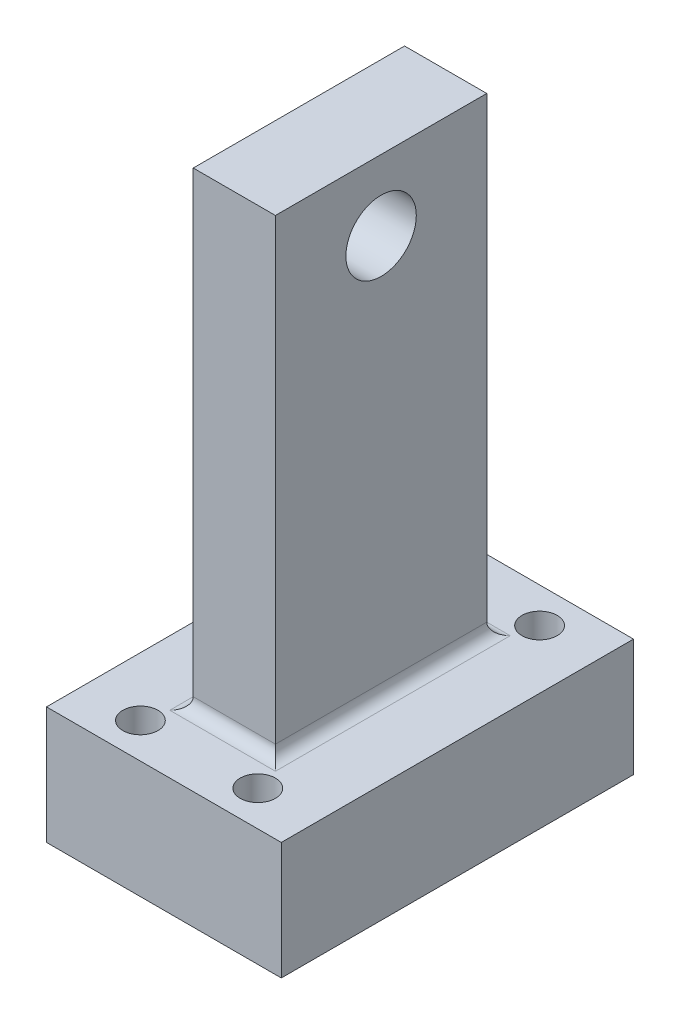
from build123d import *

# Parameters (mm, degrees)
SKETCH1_R           = 1.5
BOSS_EXTRUDE1_DEPTH = 10
SKETCH2_W           = 7
SKETCH2_H           = 18
BOSS_EXTRUDE2_DEPTH = 40
SKETCH3_R           = 3
CUT_EXTRUDE1_DEPTH  = 40
FILLET1_R           = 1


with BuildPart() as part:
    # Sketch1 → Boss-Extrude1 (new body)
    with BuildSketch(Plane(origin=(0, 0, 0), x_dir=(1, 0, 0), z_dir=(0, 1, 0))):
        Polygon((0, 30), (0, 0), (10, 0), (20, 0), (20, 30), align=None)
        with Locations(Location((5, 3, 0), (0, 0, 270))):
            Circle(SKETCH1_R, mode=Mode.SUBTRACT)
        with Locations(Location((15, 3, 0), (0, 0, 270))):
            Circle(SKETCH1_R, mode=Mode.SUBTRACT)
        with Locations(Location((5, 27, 0), (0, 0, 270))):
            Circle(SKETCH1_R, mode=Mode.SUBTRACT)
        with Locations(Location((15, 27, 0), (0, 0, 270))):
            Circle(SKETCH1_R, mode=Mode.SUBTRACT)
    extrude(amount=BOSS_EXTRUDE1_DEPTH)

    # Sketch2 → Boss-Extrude2 (add)
    with BuildSketch(Plane(origin=(0, 10, 0), x_dir=(1, 0, 0), z_dir=(0, 1, 0))):
        with Locations((10, 15)):
            Rectangle(SKETCH2_W, SKETCH2_H)
    extrude(amount=BOSS_EXTRUDE2_DEPTH)

    # Sketch3 → Cut-Extrude1 (cut)
    with BuildSketch(Plane(origin=(13.5, 0, 0), x_dir=(0, 0, -1), z_dir=(1, 0, 0))):
        with Locations((15, 44)):
            Circle(SKETCH3_R)
    extrude(amount=-CUT_EXTRUDE1_DEPTH, mode=Mode.SUBTRACT)

    # Fillet1
    fillet1_edges = [part.edges().sort_by_distance(p)[0] for p in [
        (13.5, 10, -15),
        (10, 10, -24),
        (6.5, 10, -15),
        (10, 10, -6),
    ]]
    fillet(fillet1_edges, radius=FILLET1_R)


solid = part.part
